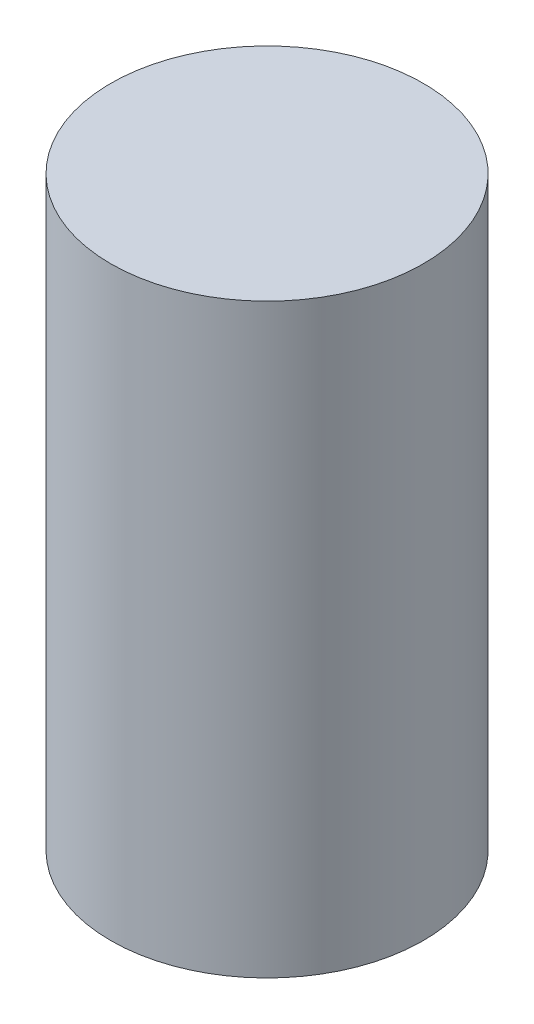
from build123d import *

# Parameters (mm, degrees)
ESQUISSE1_R      = 40
EXTRUSION1_DEPTH = 150


with BuildPart() as part:
    # Esquisse1 → Extrusion1 (new body)
    with BuildSketch(Plane(origin=(0, 0, 0), x_dir=(1, 0, 0), z_dir=(0, 1, 0))):
        with Locations(Location((0, 0, 0), (0, 0, 270))):
            Circle(ESQUISSE1_R)
    extrude(amount=EXTRUSION1_DEPTH)


solid = part.part
